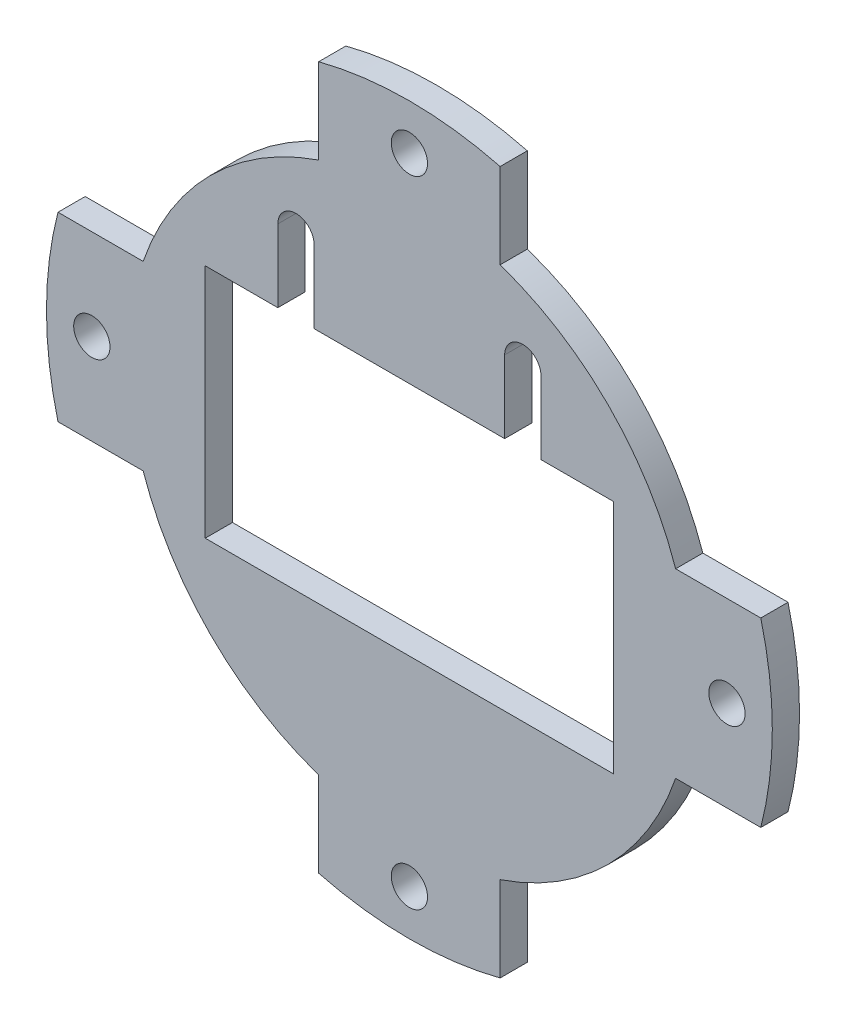
from build123d import *

# Parameters (mm, degrees)
BOSS_EXTRUDE1_DEPTH = 3
CUT_EXTRUDE1_REACH  = 58.648
SKETCH2_W           = 45
SKETCH2_H           = 26
CUT_EXTRUDE2_REACH  = 58.648
SKETCH4_R           = 2
CUT_EXTRUDE3_DEPTH  = 10


with BuildPart() as part:
    # Sketch1 → Boss-Extrude1 (new body)
    with BuildSketch(Plane.XY):
        with BuildLine():
            Line((10, 29.342801502), (10, 38.729833462))
            ThreePointArc((10, 38.729833462), (0, 40), (-10, 38.729833462))
            Line((-10, 38.729833462), (-10, 29.342801502))
            ThreePointArc((-10, 29.342801502), (-21.920310217, 21.920310217), (-29.342801502, 10))
            Line((-29.342801502, 10), (-38.729833462, 10))
            ThreePointArc((-38.729833462, 10), (-40, 0), (-38.729833462, -10))
            Line((-38.729833462, -10), (-29.342801502, -10))
            ThreePointArc((-29.342801502, -10), (-21.920310217, -21.920310217), (-10, -29.342801502))
            Line((-10, -29.342801502), (-10, -38.729833462))
            ThreePointArc((-10, -38.729833462), (0, -40), (10, -38.729833462))
            Line((10, -38.729833462), (10, -29.342801502))
            ThreePointArc((10, -29.342801502), (21.920310217, -21.920310217), (29.342801502, -10))
            Line((29.342801502, -10), (38.729833462, -10))
            ThreePointArc((38.729833462, -10), (40, 0), (38.729833462, 10))
            Line((38.729833462, 10), (29.342801502, 10))
            ThreePointArc((29.342801502, 10), (21.920310217, 21.920310217), (10, 29.342801502))
        make_face()
    extrude(amount=BOSS_EXTRUDE1_DEPTH)

    # Sketch2 → Cut-Extrude1 (cut, up to next)
    with BuildSketch(Plane.XY.offset(3), mode=Mode.PRIVATE) as cut_extrude1_sk1:
        Rectangle(SKETCH2_W, SKETCH2_H)
    cut_extrude1_tool1 = extrude(cut_extrude1_sk1.sketch, amount=-CUT_EXTRUDE1_REACH, mode=Mode.PRIVATE) & part.part
    add(cut_extrude1_tool1.solids().sort_by_distance((0, 0, 3))[0], mode=Mode.SUBTRACT)

    # Sketch3 → Cut-Extrude2 (cut, up to next)
    with BuildSketch(Plane.XY.offset(3), mode=Mode.PRIVATE) as cut_extrude2_sk1:
        with BuildLine():
            Line((-10.5, 21), (-10.5, 13))
            Line((-10.5, 13), (-14.5, 13))
            Line((-14.5, 13), (-14.5, 21))
            ThreePointArc((-14.5, 21), (-12.5, 23), (-10.5, 21))
        make_face()
    cut_extrude2_tool1 = extrude(cut_extrude2_sk1.sketch, amount=-CUT_EXTRUDE2_REACH, mode=Mode.PRIVATE) & part.part
    # Sketch3 → Cut-Extrude2 (cut, up to next)
    with BuildSketch(Plane.XY.offset(3), mode=Mode.PRIVATE) as cut_extrude2_sk2:
        with BuildLine():
            Line((10.5, 21), (10.5, 13))
            Line((10.5, 13), (14.5, 13))
            Line((14.5, 13), (14.5, 21))
            ThreePointArc((14.5, 21), (12.5, 23), (10.5, 21))
        make_face()
    cut_extrude2_tool2 = extrude(cut_extrude2_sk2.sketch, amount=-CUT_EXTRUDE2_REACH, mode=Mode.PRIVATE) & part.part
    add(cut_extrude2_tool1.solids().sort_by_distance((-12.5, 17.795808, 3))[0], mode=Mode.SUBTRACT)
    add(cut_extrude2_tool2.solids().sort_by_distance((12.5, 17.795808, 3))[0], mode=Mode.SUBTRACT)

    # Sketch4 → Cut-Extrude3 (cut)
    with BuildSketch(Plane.XY.offset(3)):
        with Locations((0, 35)):
            Circle(SKETCH4_R)
        with Locations((35, 0)):
            Circle(SKETCH4_R)
        with Locations((0, -35)):
            Circle(SKETCH4_R)
        with Locations((-35, 0)):
            Circle(SKETCH4_R)
    extrude(amount=-CUT_EXTRUDE3_DEPTH, mode=Mode.SUBTRACT)


solid = part.part
